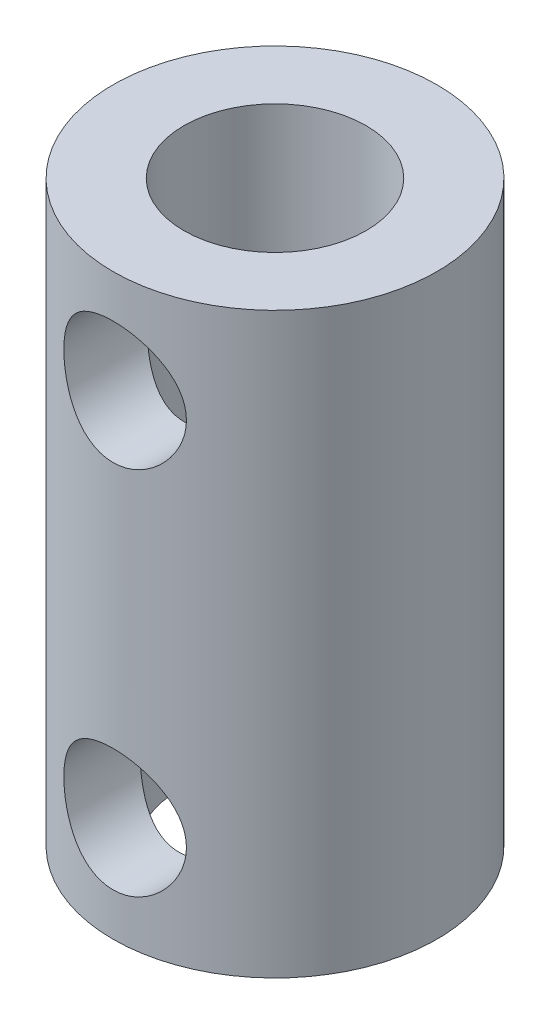
from build123d import *

# Parameters (mm, degrees)
SKETCH1_W                   = 5.334
SKETCH1_H                   = 19.05
M3_5_CLEARANCE_HOLE1_REACH  = 21.654
M3_5_CLEARANCE_HOLE1_BORE_R = 2.0193
M3_5_CLEARANCE_HOLE2_REACH  = 21.654
M3_5_CLEARANCE_HOLE2_BORE_R = 2.0193


with BuildPart() as part:
    # Sketch1 → Revolve1 (revolve)
    with BuildSketch(Plane.XY, mode=Mode.PRIVATE) as revolve1_sk:
        with Locations((2.667, 9.525)):
            Rectangle(SKETCH1_W, SKETCH1_H)
    revolve(revolve1_sk.sketch.rotate(Axis((0, 19.05, 0), (0, -1, 0)), 270), axis=Axis((0, 19.05, 0), (0, -1, 0)))

    # Sketch2 → Hole1 (revolve, cut)
    with BuildSketch(Plane(origin=(0, 0, 0), x_dir=(0, 0, -1), z_dir=(1, 0, 0))):
        Polygon((0, 0), (0, 19.05), (3, 19.05), (3, 9.630150608), (3.175, 9.525), (3.175, 0), align=None)
    revolve(axis=Axis((0, -6.130023899, 0), (0, 1, 0)), mode=Mode.SUBTRACT)

    # M3.5 Clearance Hole1 bore (on position points) → M3.5 Clearance Hole1 (cut, up to next)
    with BuildSketch(Plane(origin=(0, 15.621, 5.334), x_dir=(1, 0, 0), z_dir=(0, 0, 1)), mode=Mode.PRIVATE) as m3_5_clearance_hole1_sk1:
        Circle(M3_5_CLEARANCE_HOLE1_BORE_R)
    m3_5_clearance_hole1_tool1 = extrude(m3_5_clearance_hole1_sk1.sketch, amount=-M3_5_CLEARANCE_HOLE1_REACH, mode=Mode.PRIVATE) & part.part
    add(m3_5_clearance_hole1_tool1.solids().sort_by_distance((0, 15.621, 5.334))[0], mode=Mode.SUBTRACT)

    # M3.5 Clearance Hole2 bore (on position points) → M3.5 Clearance Hole2 (cut, up to next)
    with BuildSketch(Plane(origin=(0, 3.429, 5.334), x_dir=(1, 0, 0), z_dir=(0, 0, 1)), mode=Mode.PRIVATE) as m3_5_clearance_hole2_sk1:
        Circle(M3_5_CLEARANCE_HOLE2_BORE_R)
    m3_5_clearance_hole2_tool1 = extrude(m3_5_clearance_hole2_sk1.sketch, amount=-M3_5_CLEARANCE_HOLE2_REACH, mode=Mode.PRIVATE) & part.part
    add(m3_5_clearance_hole2_tool1.solids().sort_by_distance((0, 3.429, 5.334))[0], mode=Mode.SUBTRACT)


solid = part.part
